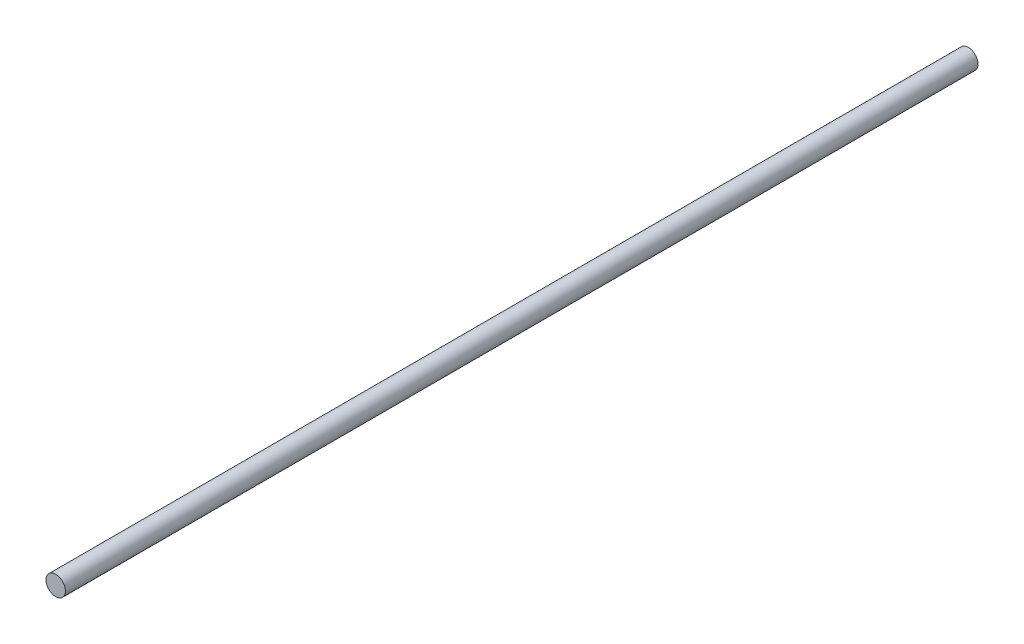
from build123d import *

# Parameters (mm, degrees)
SKETCH_1_R      = 10
EXTRUDE_1_DEPTH = 940


with BuildPart() as part:
    # 草图1 → 凸台-拉伸1 (new body)
    with BuildSketch(Plane.XY):
        with Locations(Location((0, 0, 0), (0, 0, 180))):
            Circle(SKETCH_1_R)
    extrude(amount=EXTRUDE_1_DEPTH)


solid = part.part
